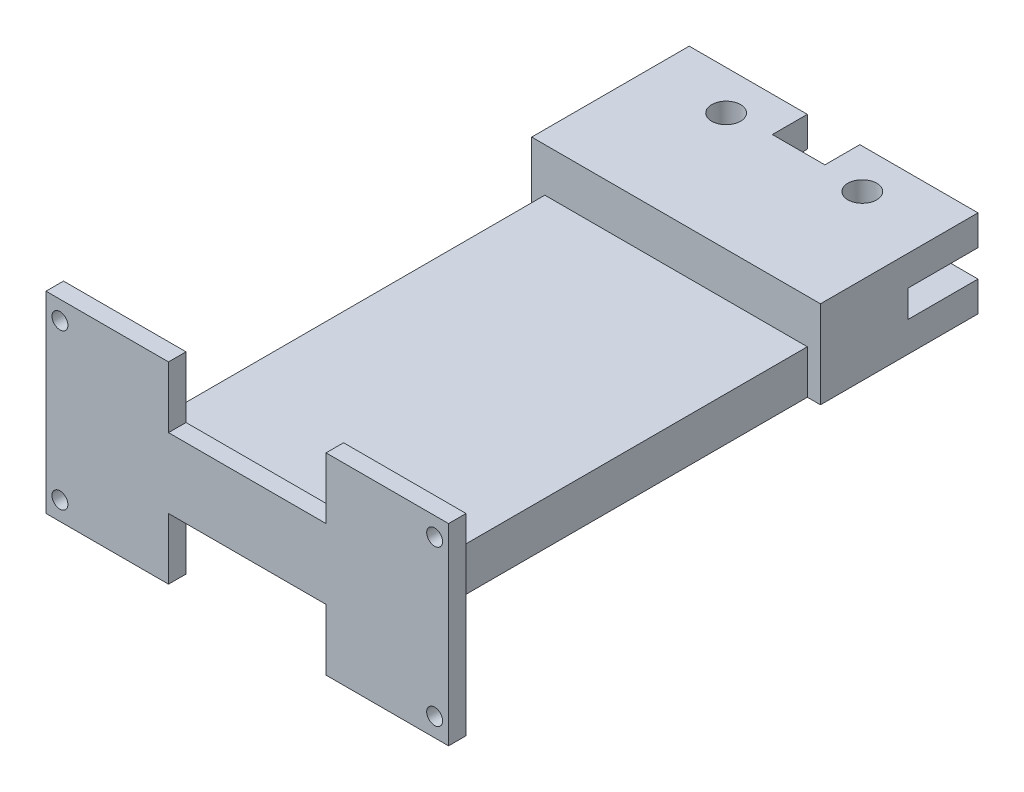
from build123d import *

# Parameters (mm, degrees)
SKETCH_1_W          = 18
SKETCH_1_H          = 10
EXTRUDE_1_DEPTH     = 16.5
SKETCH_2_W          = 8
SKETCH_2_H          = 3.1
CUT_EXTRUDE_1_DEPTH = 40
SKETCH_3_R          = 1.65
CUT_EXTRUDE_2_DEPTH = 20
SKETCH_5_W          = 6
SKETCH_5_H          = 8
CUT_EXTRUDE_3_DEPTH = 20
SKETCH_6_W          = 30
SKETCH_6_H          = 5
EXTRUDE_2_DEPTH     = 47
SKETCH_7_W          = 46
SKETCH_7_H          = 22
SKETCH_7_R          = 0.91
EXTRUDE_3_DEPTH     = 2
SKETCH_8_W          = 18
SKETCH_8_H          = 7
CUT_EXTRUDE_4_DEPTH = 10


with BuildPart() as part:
    # 草图1 → 凸台-拉伸1 (new, symmetric)
    with BuildSketch(Plane(origin=(0, 0, 0), x_dir=(0, 0, -1), z_dir=(1, 0, 0))):
        Rectangle(SKETCH_1_W, SKETCH_1_H)
    extrude(amount=EXTRUDE_1_DEPTH, both=True)

    # 草图2 → 切除-拉伸1 (cut)
    with BuildSketch(Plane.ZY.offset(16.5)):
        with Locations((-5, 0)):
            Rectangle(SKETCH_2_W, SKETCH_2_H)
    extrude(amount=-CUT_EXTRUDE_1_DEPTH, mode=Mode.SUBTRACT)

    # 草图3 → 切除-拉伸2 (cut)
    with BuildSketch(Plane(origin=(0, 5, 0), x_dir=(1, 0, 0), z_dir=(0, 1, 0))):
        with Locations(Location((-7.78, 4.5, 0), (0, 0, 270))):
            Circle(SKETCH_3_R)
        with Locations(Location((7.78, 4.5, 0), (0, 0, 270))):
            Circle(SKETCH_3_R)
    extrude(amount=-CUT_EXTRUDE_2_DEPTH, mode=Mode.SUBTRACT)

    # 草图5 → 切除-拉伸3 (cut)
    with BuildSketch(Plane(origin=(0, 5, 0), x_dir=(1, 0, 0), z_dir=(0, 1, 0))):
        with Locations((0, 9)):
            Rectangle(SKETCH_5_W, SKETCH_5_H)
    extrude(amount=-CUT_EXTRUDE_3_DEPTH, mode=Mode.SUBTRACT)

    # 草图6 → 凸台-拉伸2 (add)
    with BuildSketch(Plane.XY.offset(9)):
        with Locations((0, -2.5)):
            Rectangle(SKETCH_6_W, SKETCH_6_H)
    extrude(amount=EXTRUDE_2_DEPTH)

    # 草图7 → 凸台-拉伸3 (add)
    with BuildSketch(Plane.XY.offset(56)):
        Rectangle(SKETCH_7_W, SKETCH_7_H)
        with Locations((-21.41, 8.87)):
            Circle(SKETCH_7_R, mode=Mode.SUBTRACT)
        with Locations(Location((21.41, 8.87, 0), (0, 0, 180))):
            Circle(SKETCH_7_R, mode=Mode.SUBTRACT)
        with Locations((21.41, -8.87)):
            Circle(SKETCH_7_R, mode=Mode.SUBTRACT)
        with Locations(Location((-21.41, -8.87, 0), (0, 0, 180))):
            Circle(SKETCH_7_R, mode=Mode.SUBTRACT)
    extrude(amount=EXTRUDE_3_DEPTH)

    # 草图8 → 切除-拉伸4 (cut)
    with BuildSketch(Plane.XY.offset(58)):
        with Locations((0, 7.5)):
            Rectangle(SKETCH_8_W, SKETCH_8_H)
        with Locations((0, -7.5)):
            Rectangle(SKETCH_8_W, SKETCH_8_H)
    extrude(amount=-CUT_EXTRUDE_4_DEPTH, mode=Mode.SUBTRACT)


solid = part.part
